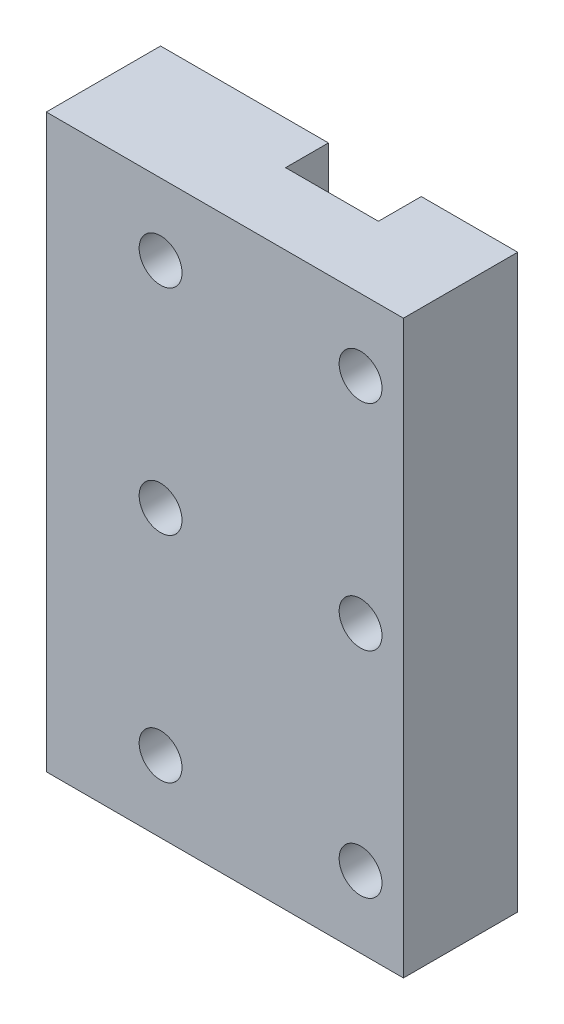
from build123d import *

# Parameters (mm, degrees)
SKETCH1_W           = 25
SKETCH1_H           = 40
SKETCH1_R           = 1.5
BOSS_EXTRUDE1_DEPTH = 8
SKETCH2_W           = 6.5
SKETCH2_H           = 40
CUT_EXTRUDE1_DEPTH  = 3
CUT_EXTRUDE2_DEPTH  = 6.5
LPATTERN1_COUNT     = 23
LPATTERN1_PITCH     = 1.923


with BuildPart() as part:
    # Sketch1 → Boss-Extrude1 (new body)
    with BuildSketch(Plane.XY):
        Rectangle(SKETCH1_W, SKETCH1_H)
        with Locations((-4.5, 15)):
            Circle(SKETCH1_R, mode=Mode.SUBTRACT)
        with Locations((9.5, 15)):
            Circle(SKETCH1_R, mode=Mode.SUBTRACT)
        with Locations((-4.5, 0)):
            Circle(SKETCH1_R, mode=Mode.SUBTRACT)
        with Locations((9.5, 0)):
            Circle(SKETCH1_R, mode=Mode.SUBTRACT)
        with Locations((-4.5, -15)):
            Circle(SKETCH1_R, mode=Mode.SUBTRACT)
        with Locations((9.5, -15)):
            Circle(SKETCH1_R, mode=Mode.SUBTRACT)
    extrude(amount=BOSS_EXTRUDE1_DEPTH)

    # Sketch2 → Cut-Extrude1 (cut)
    with BuildSketch(Plane(origin=(0, 0, 0), x_dir=(-1, 0, 0), z_dir=(0, 0, -1))):
        with Locations((-2.5, 0)):
            Rectangle(SKETCH2_W, SKETCH2_H)
    extrude(amount=-CUT_EXTRUDE1_DEPTH, mode=Mode.SUBTRACT)

    # Sketch3 → Cut-Extrude2 (cut)
    with BuildSketch(Plane(origin=(-0.75, 0, 0), x_dir=(0, 0, -1), z_dir=(1, 0, 0))):
        with BuildLine():
            Line((-3, 19.5), (-3, 18.5))
            ThreePointArc((-3, 18.5), (-3.5, 19), (-3, 19.5))
        make_face()
    cut_extrude2 = extrude(amount=CUT_EXTRUDE2_DEPTH, mode=Mode.SUBTRACT)

    # LPattern1: Cut-Extrude2 ×23
    with Locations(*[(0, -i * LPATTERN1_PITCH, 0) for i in range(1, LPATTERN1_COUNT)]):
        add(cut_extrude2, mode=Mode.SUBTRACT)


solid = part.part
